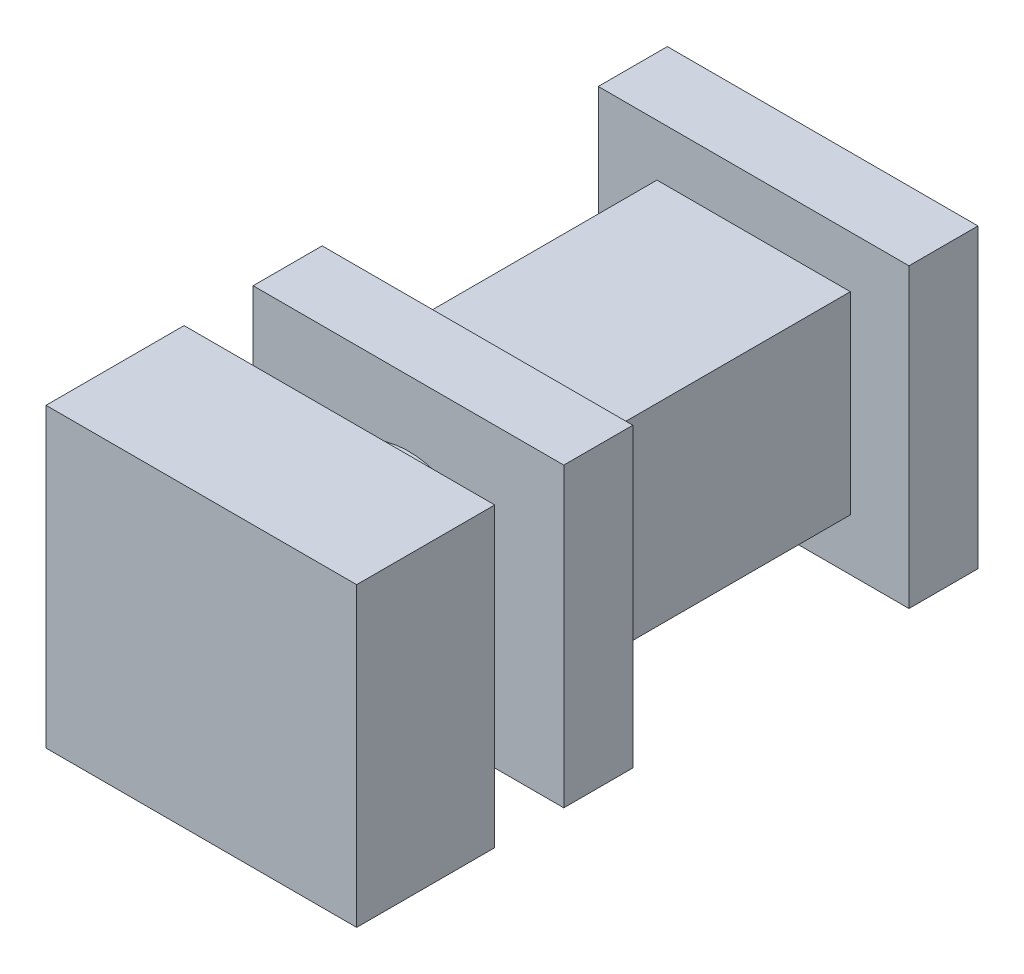
from build123d import *

# Parameters (mm, degrees)
SKETCH_2_W      = 2.25
SKETCH_2_H      = 2.15
EXTRUDE_4_DEPTH = 1
SKETCH_4_R      = 0.6
EXTRUDE_5_DEPTH = 0.5
SKETCH_5_W      = 2.25
SKETCH_5_H      = 2.15
EXTRUDE_6_DEPTH = 0.5
SKETCH_9_W      = 1.4
SKETCH_9_H      = 1.4
EXTRUDE_7_DEPTH = 2
SKETCH_10_W     = 2.25
SKETCH_10_H     = 2.15
EXTRUDE_8_DEPTH = 0.5


with BuildPart() as part:
    # 草图2 → 凸台-拉伸4 (new body)
    with BuildSketch(Plane.XY):
        Rectangle(SKETCH_2_W, SKETCH_2_H)
    extrude(amount=EXTRUDE_4_DEPTH)

    # 草图4 → 凸台-拉伸5 (add)
    with BuildSketch(Plane(origin=(0, 0, 0), x_dir=(-1, 0, 0), z_dir=(0, 0, -1))):
        Circle(SKETCH_4_R)
    extrude(amount=EXTRUDE_5_DEPTH)

    # 草图5 → 凸台-拉伸6 (add)
    with BuildSketch(Plane(origin=(0, 0, -0.5), x_dir=(-1, 0, 0), z_dir=(0, 0, -1))):
        Rectangle(SKETCH_5_W, SKETCH_5_H)
    extrude(amount=EXTRUDE_6_DEPTH)

    # 草图9 → 凸台-拉伸7 (add)
    with BuildSketch(Plane(origin=(0, 0, -1), x_dir=(-1, 0, 0), z_dir=(0, 0, -1))):
        Rectangle(SKETCH_9_W, SKETCH_9_H)
    extrude(amount=EXTRUDE_7_DEPTH)

    # 草图10 → 凸台-拉伸8 (add)
    with BuildSketch(Plane(origin=(0, 0, -3), x_dir=(-1, 0, 0), z_dir=(0, 0, -1))):
        Rectangle(SKETCH_10_W, SKETCH_10_H)
    extrude(amount=EXTRUDE_8_DEPTH)


solid = part.part
